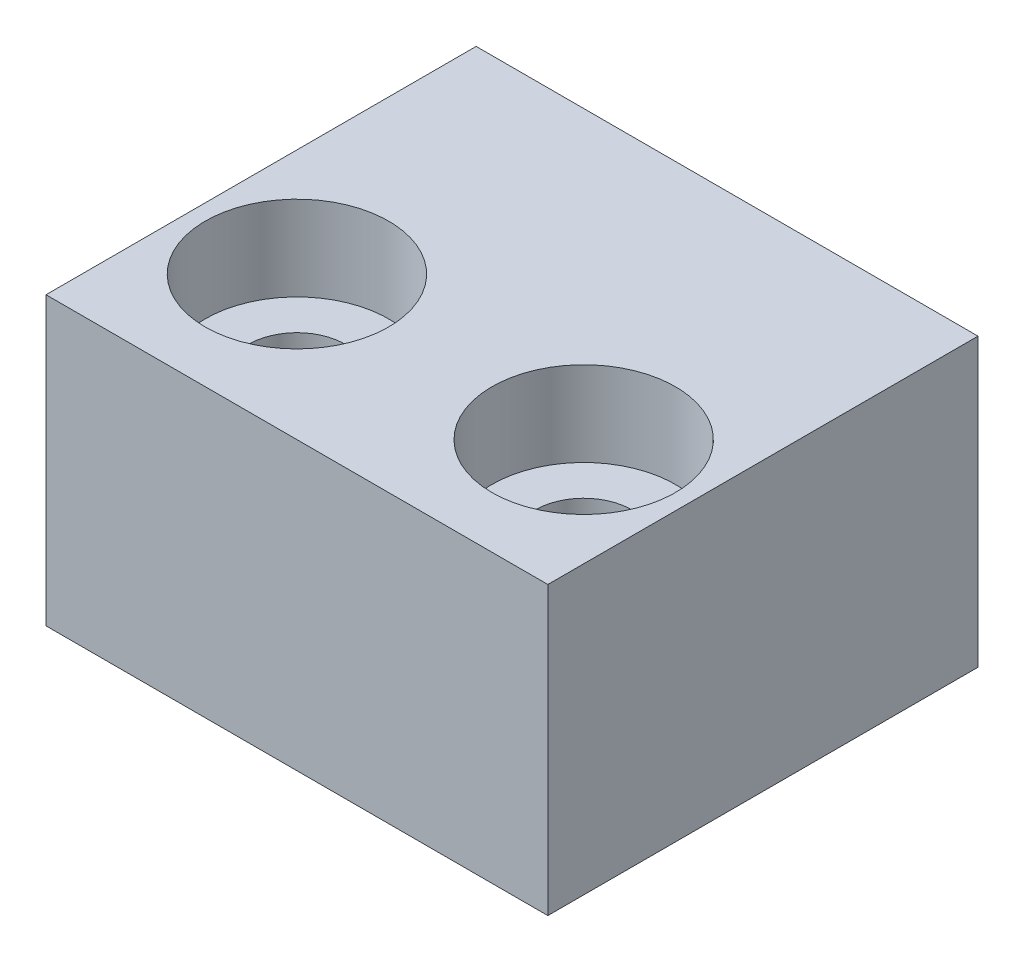
from build123d import *

# Parameters (mm, degrees)
SKETCH1_W                      = 17.78
SKETCH1_H                      = 15.24
BOSS_EXTRUDE1_DEPTH            = 10.16
CBORE_FOR_M3_SHCS1_D           = 3.4
CBORE_FOR_M3_SHCS1_CBORE_D     = 6.5
CBORE_FOR_M3_SHCS1_CBORE_DEPTH = 3


with BuildPart() as part:
    # Sketch1 → Boss-Extrude1 (new body)
    with BuildSketch(Plane(origin=(0, 0, 0), x_dir=(1, 0, 0), z_dir=(0, 1, 0))):
        with Locations((8.89, 7.62)):
            Rectangle(SKETCH1_W, SKETCH1_H)
    extrude(amount=BOSS_EXTRUDE1_DEPTH)

    # CBORE for M3 SHCS1 (through all)
    with Locations(Plane(origin=(0, 10.16, 0), x_dir=(1, 0, 0), z_dir=(0, 1, 0))):
        with Locations((3.81, 5.08), (13.97, 5.08)):
            CounterBoreHole(CBORE_FOR_M3_SHCS1_D / 2, CBORE_FOR_M3_SHCS1_CBORE_D / 2, CBORE_FOR_M3_SHCS1_CBORE_DEPTH)


solid = part.part
